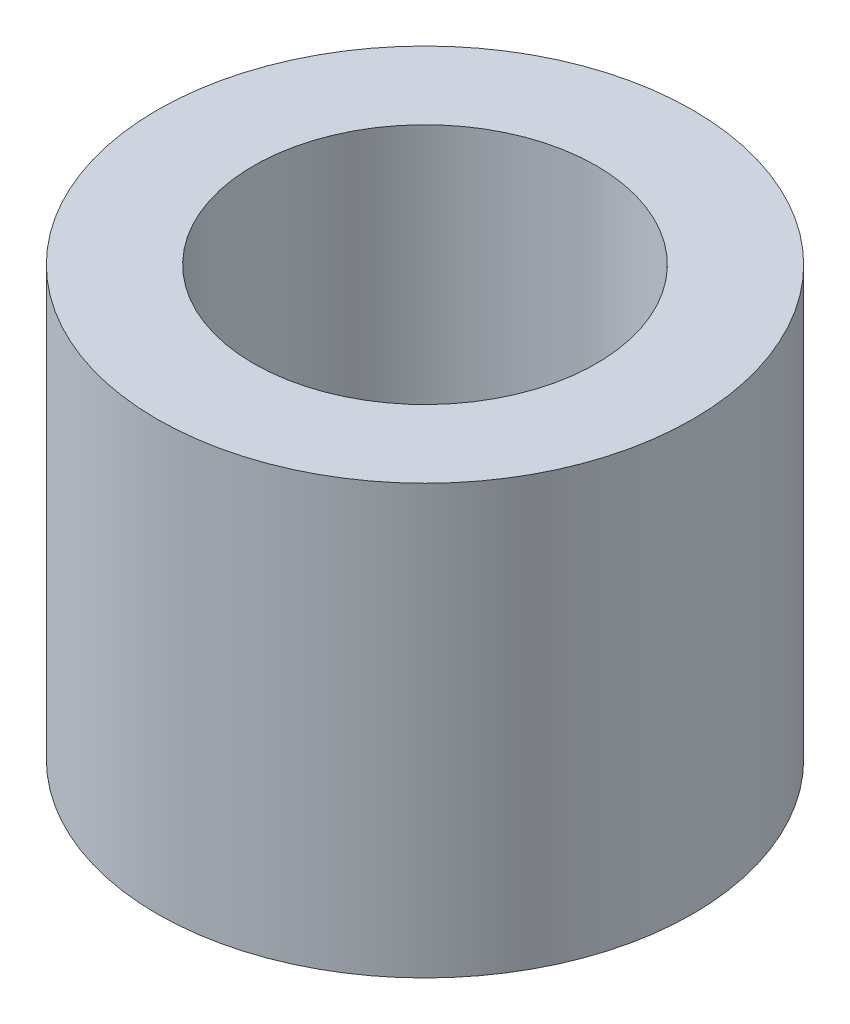
from build123d import *

# Parameters (mm, degrees)
SKETCH1_R           = 3.175
BOSS_EXTRUDE1_DEPTH = 5.08
SKETCH2_R           = 2.032
CUT_EXTRUDE1_DEPTH  = 7.77994469


with BuildPart() as part:
    # Sketch1 → Boss-Extrude1 (new body)
    with BuildSketch(Plane(origin=(0, 0, 0), x_dir=(1, 0, 0), z_dir=(0, 1, 0))):
        with Locations(Location((0, 0, 0), (0, 0, 270))):
            Circle(SKETCH1_R)
    extrude(amount=BOSS_EXTRUDE1_DEPTH)

    # Sketch2 → Cut-Extrude1 (cut, through all)
    with BuildSketch(Plane(origin=(0, 5.08, 0), x_dir=(1, 0, 0), z_dir=(0, 1, 0))):
        with Locations(Location((0, 0, 0), (0, 0, 270))):
            Circle(SKETCH2_R)
    extrude(amount=-CUT_EXTRUDE1_DEPTH, mode=Mode.SUBTRACT)


solid = part.part
